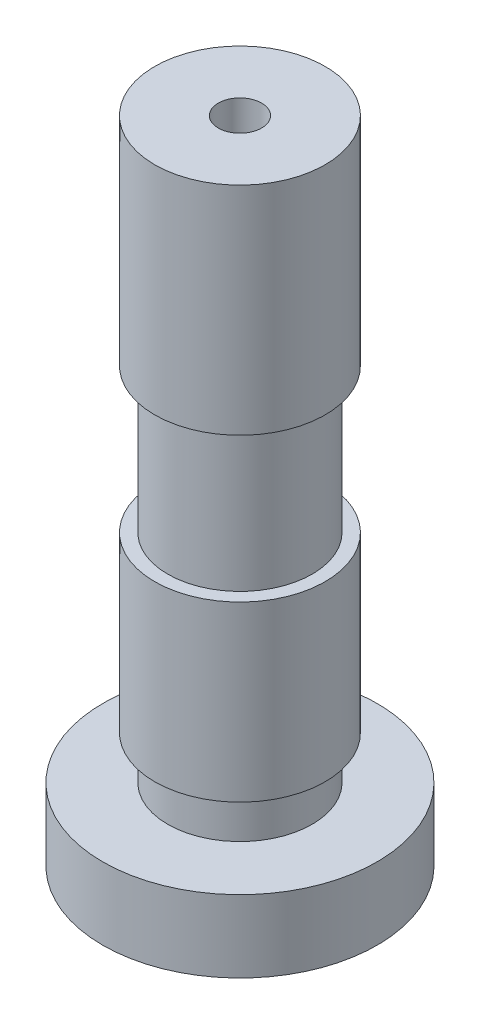
from build123d import *

# Parameters (mm, degrees)
SKETCH_2_R          = 1.5
CUT_EXTRUDE_1_DEPTH = 3
CUT_EXTRUDE_START   = -3
SKETCH_3_R          = 1.5
CUT_EXTRUDE_2_DEPTH = 3


with BuildPart() as part:
    # Эскиз1 → Повернуть1 (revolve)
    with BuildSketch(Plane.XY, mode=Mode.PRIVATE) as revolve_1_sk:
        Polygon((0, 0), (9.5, 0), (9.5, 5), (5, 5), (5, 8), (5.9, 8), (5.9, 20), (5, 20), (5, 30), (5.9, 30), (5.9, 45), (0, 45), align=None)
    revolve(revolve_1_sk.sketch.rotate(Axis((0, 14.6467512, 0), (0, -1, 0)), 90), axis=Axis((0, 14.6467512, 0), (0, -1, 0)))

    # Эскиз2 → Вырез-Вытянуть1 (cut)
    with BuildSketch(Plane(origin=(0, 45, 0), x_dir=(1, 0, 0), z_dir=(0, 1, 0))):
        with Locations(Location((0, 0, 0), (0, 0, 270))):
            Circle(SKETCH_2_R)
    extrude(amount=-CUT_EXTRUDE_1_DEPTH, mode=Mode.SUBTRACT)

    # Эскиз3 → Вырез-Вытянуть2 (cut)
    with BuildSketch(Plane(origin=(0, 0, 0), x_dir=(-1, 0, 0), z_dir=(0, -1, 0)).offset(CUT_EXTRUDE_START)):
        with Locations(Location((0, 0, 0), (0, 0, 270))):
            Circle(SKETCH_3_R)
    extrude(amount=CUT_EXTRUDE_2_DEPTH, mode=Mode.SUBTRACT)


solid = part.part
